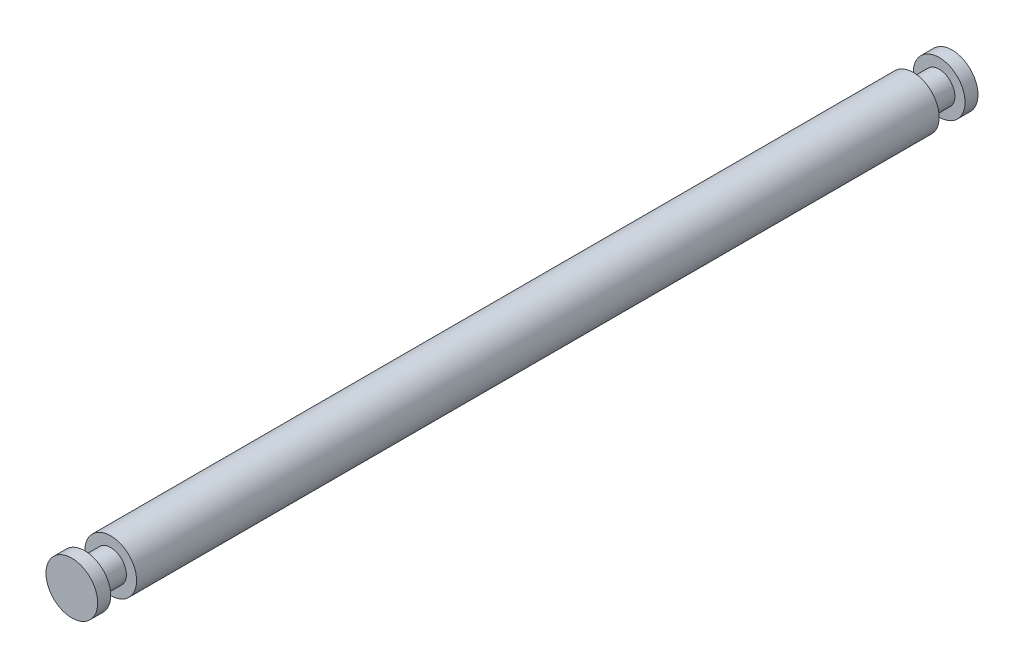
from build123d import *

# Parameters (mm, degrees)
SKETCH2_W = 1.27
SKETCH2_H = 43.18
SKETCH3_W = 0.499412869
SKETCH3_H = 1.27


with BuildPart() as part:
    # Sketch2 → Revolve1 (revolve)
    with BuildSketch(Plane(origin=(0, 0, 0), x_dir=(1, 0, 0), z_dir=(0, 1, 0))):
        with Locations((0.635, 21.59)):
            Rectangle(SKETCH2_W, SKETCH2_H)
    revolve(axis=Axis((0, 0, 0), (0, 0, -1)))

    # Sketch3 → Cut-Revolve1 (revolve, cut)
    with BuildSketch(Plane(origin=(0, 0, 0), x_dir=(1, 0, 0), z_dir=(0, 1, 0))):
        with Locations((1.020293566, 1.27)):
            Rectangle(SKETCH3_W, SKETCH3_H)
    cut_revolve1 = revolve(axis=Axis((0, 0, 0), (0, 0, -1)), mode=Mode.SUBTRACT)

    # Mirror1: Cut-Revolve1 across plane
    add(cut_revolve1.mirror(Plane.XY.offset(-21.59)), mode=Mode.SUBTRACT)


solid = part.part
